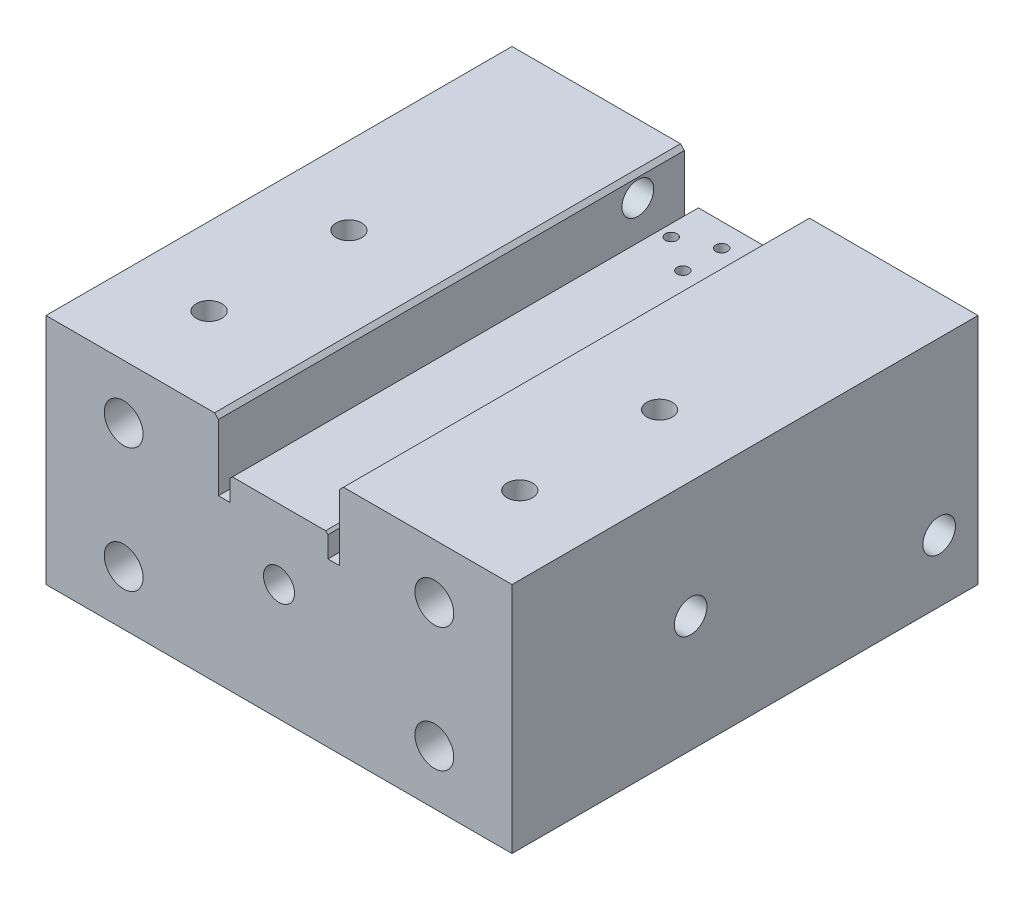
from build123d import *

# Parameters (mm, degrees)
SKETCH_1_W                = 60
SKETCH_1_H                = 30
EXTRUDE_1_DEPTH           = 60
SKETCH_2_W                = 15.6
SKETCH_2_H                = 6
CUT_EXTRUDE_1_DEPTH       = 91
SKETCH_3_W                = 1.5
SKETCH_3_H                = 3
CUT_EXTRUDE_2_DEPTH       = 91
CHAMFER_1_SIZE            = 0.3
CHAMFER_2_SIZE            = 0.5
HOLE_WIZARD_M6_1_D        = 5
HOLE_WIZARD_M6_1_DEPTH    = 15
HOLE_WIZARD_M6_1_TIP      = 1.502151548
SKETCH_6_R                = 2.05
CUT_EXTRUDE_3_DEPTH       = 22.2
HOLE_WIZARD_6_0_6_1_D     = 4
HOLE_WIZARD_6_0_6_1_DEPTH = 58
HOLE_WIZARD_6_0_6_1_TIP   = 1.201721238
HOLE_WIZARD_M5_1_D        = 4.2
HOLE_WIZARD_M5_1_DEPTH    = 12.4
HOLE_WIZARD_M5_1_TIP      = 1.2618073
SKETCH_12_R               = 2
CUT_EXTRUDE_4_DEPTH       = 33
SKETCH_13_R               = 0.75
CUT_EXTRUDE_5_DEPTH       = 10
HOLE_WIZARD_M5_2_D        = 4.2
HOLE_WIZARD_M5_2_DEPTH    = 12.4
HOLE_WIZARD_M5_2_TIP      = 1.2618073
SKETCH_16_R               = 2
CUT_EXTRUDE_6_DEPTH       = 40
SKETCH_17_R               = 0.75
CUT_EXTRUDE_7_DEPTH       = 15
HOLE_WIZARD_M4_1_D        = 3.3
HOLE_WIZARD_M4_1_DEPTH    = 10.1
HOLE_WIZARD_M4_1_TIP      = 0.991420021
HOLE_WIZARD_M4_2_D        = 3.3
HOLE_WIZARD_M4_2_DEPTH    = 10.1
HOLE_WIZARD_M4_2_TIP      = 0.991420021


with BuildPart() as part:
    # 草图1 → 凸台-拉伸1 (new body)
    with BuildSketch(Plane.XY):
        with Locations((30, 15)):
            Rectangle(SKETCH_1_W, SKETCH_1_H)
    extrude(amount=EXTRUDE_1_DEPTH)

    # 草图2 → 切除-拉伸1 (cut, through all)
    with BuildSketch(Plane(origin=(0, 0, 0), x_dir=(-1, 0, 0), z_dir=(0, 0, -1))):
        with Locations((-30, 27)):
            Rectangle(SKETCH_2_W, SKETCH_2_H)
    extrude(amount=-CUT_EXTRUDE_1_DEPTH, mode=Mode.SUBTRACT)

    # 草图3 → 切除-拉伸2 (cut, through all)
    with BuildSketch(Plane(origin=(0, 0, 0), x_dir=(-1, 0, 0), z_dir=(0, 0, -1))):
        with Locations((-37.05, 22.5)):
            Rectangle(SKETCH_3_W, SKETCH_3_H)
        with Locations((-22.95, 22.5)):
            Rectangle(SKETCH_3_W, SKETCH_3_H)
    extrude(amount=-CUT_EXTRUDE_2_DEPTH, mode=Mode.SUBTRACT)

    # 倒角1
    chamfer_1_edges = [part.edges().sort_by_distance(p)[0] for p in [
        (36.3, 24, 30),
        (23.7, 24, 30),
    ]]
    chamfer(chamfer_1_edges, length=CHAMFER_1_SIZE)

    # 倒角2
    chamfer_2_edges = [part.edges().sort_by_distance(p)[0] for p in [
        (22.2, 30, 30),
        (37.8, 30, 30),
    ]]
    chamfer(chamfer_2_edges, length=CHAMFER_2_SIZE)

    # M6 螺纹孔1
    with Locations(Plane.XY.offset(60)):
        with Locations((10, 23), (50, 23), (50, 7), (10, 7)):
            Hole(HOLE_WIZARD_M6_1_D / 2, depth=HOLE_WIZARD_M6_1_DEPTH)
            with Locations((0, 0, -(HOLE_WIZARD_M6_1_DEPTH + HOLE_WIZARD_M6_1_TIP / 2))):  # 118° drill point
                Cone(0, HOLE_WIZARD_M6_1_D / 2, HOLE_WIZARD_M6_1_TIP, mode=Mode.SUBTRACT)

    # 草图6 → 切除-拉伸3 (cut)
    with BuildSketch(Plane.ZY):
        with Locations((6, 27.2)):
            Circle(SKETCH_6_R)
    extrude(amount=-CUT_EXTRUDE_3_DEPTH, mode=Mode.SUBTRACT)

    # Ø6.0 (6) 直径孔1
    with Locations(Plane.XY.offset(60)):
        with Locations((30, 15)):
            Hole(HOLE_WIZARD_6_0_6_1_D / 2, depth=HOLE_WIZARD_6_0_6_1_DEPTH)
            with Locations((0, 0, -(HOLE_WIZARD_6_0_6_1_DEPTH + HOLE_WIZARD_6_0_6_1_TIP / 2))):  # 118° drill point
                Cone(0, HOLE_WIZARD_6_0_6_1_D / 2, HOLE_WIZARD_6_0_6_1_TIP, mode=Mode.SUBTRACT)

    # M5 螺纹孔1
    with Locations(Plane(origin=(60, 0, 0), x_dir=(0, 0, -1), z_dir=(1, 0, 0))):
        with Locations((-37, 15)):
            Hole(HOLE_WIZARD_M5_1_D / 2, depth=HOLE_WIZARD_M5_1_DEPTH)
            with Locations((0, 0, -(HOLE_WIZARD_M5_1_DEPTH + HOLE_WIZARD_M5_1_TIP / 2))):  # 118° drill point
                Cone(0, HOLE_WIZARD_M5_1_D / 2, HOLE_WIZARD_M5_1_TIP, mode=Mode.SUBTRACT)

    # 草图12 → 切除-拉伸4 (cut)
    with BuildSketch(Plane(origin=(60, 0, 0), x_dir=(0, 0, -1), z_dir=(1, 0, 0))):
        with Locations((-37, 15)):
            Circle(SKETCH_12_R)
    extrude(amount=-CUT_EXTRUDE_4_DEPTH, mode=Mode.SUBTRACT)

    # 草图13 → 切除-拉伸5 (cut)
    with BuildSketch(Plane(origin=(0, 24, 0), x_dir=(1, 0, 0), z_dir=(0, 1, 0))):
        with Locations(Location((30, -3, 0), (0, 0, 180))):
            Circle(SKETCH_13_R)
        with Locations(Location((30, -8, 0), (0, 0, 180))):
            Circle(SKETCH_13_R)
    extrude(amount=-CUT_EXTRUDE_5_DEPTH, mode=Mode.SUBTRACT)

    # M5 螺纹孔2
    with Locations(Plane(origin=(60, 0, 0), x_dir=(0, 0, -1), z_dir=(1, 0, 0))):
        with Locations((-5, 8)):
            Hole(HOLE_WIZARD_M5_2_D / 2, depth=HOLE_WIZARD_M5_2_DEPTH)
            with Locations((0, 0, -(HOLE_WIZARD_M5_2_DEPTH + HOLE_WIZARD_M5_2_TIP / 2))):  # 118° drill point
                Cone(0, HOLE_WIZARD_M5_2_D / 2, HOLE_WIZARD_M5_2_TIP, mode=Mode.SUBTRACT)

    # 草图16 → 切除-拉伸6 (cut)
    with BuildSketch(Plane(origin=(60, 0, 0), x_dir=(0, 0, -1), z_dir=(1, 0, 0))):
        with Locations((-5, 8)):
            Circle(SKETCH_16_R)
    extrude(amount=-CUT_EXTRUDE_6_DEPTH, mode=Mode.SUBTRACT)

    # 草图17 → 切除-拉伸7 (cut)
    with BuildSketch(Plane(origin=(0, 24, 0), x_dir=(1, 0, 0), z_dir=(0, 1, 0))):
        with Locations(Location((25.5, -5, 0), (0, 0, 180))):
            Circle(SKETCH_17_R)
        with Locations(Location((34.5, -5, 0), (0, 0, 180))):
            Circle(SKETCH_17_R)
    extrude(amount=-CUT_EXTRUDE_7_DEPTH, mode=Mode.SUBTRACT)

    # M4 螺纹孔1
    with Locations(Plane(origin=(0, 0, 0), x_dir=(-1, 0, 0), z_dir=(0, 0, -1))):
        with Locations((-53, 25), (-53, 15), (-7, 15), (-7, 25)):
            Hole(HOLE_WIZARD_M4_1_D / 2, depth=HOLE_WIZARD_M4_1_DEPTH)
            with Locations((0, 0, -(HOLE_WIZARD_M4_1_DEPTH + HOLE_WIZARD_M4_1_TIP / 2))):  # 118° drill point
                Cone(0, HOLE_WIZARD_M4_1_D / 2, HOLE_WIZARD_M4_1_TIP, mode=Mode.SUBTRACT)

    # M4 螺纹孔2
    with Locations(Plane(origin=(0, 30, 0), x_dir=(-1, 0, 0), z_dir=(0, 1, 0))):
        with Locations((-50, 31), (-50, 49), (-10, 49), (-10, 31)):
            Hole(HOLE_WIZARD_M4_2_D / 2, depth=HOLE_WIZARD_M4_2_DEPTH)
            with Locations((0, 0, -(HOLE_WIZARD_M4_2_DEPTH + HOLE_WIZARD_M4_2_TIP / 2))):  # 118° drill point
                Cone(0, HOLE_WIZARD_M4_2_D / 2, HOLE_WIZARD_M4_2_TIP, mode=Mode.SUBTRACT)


solid = part.part
